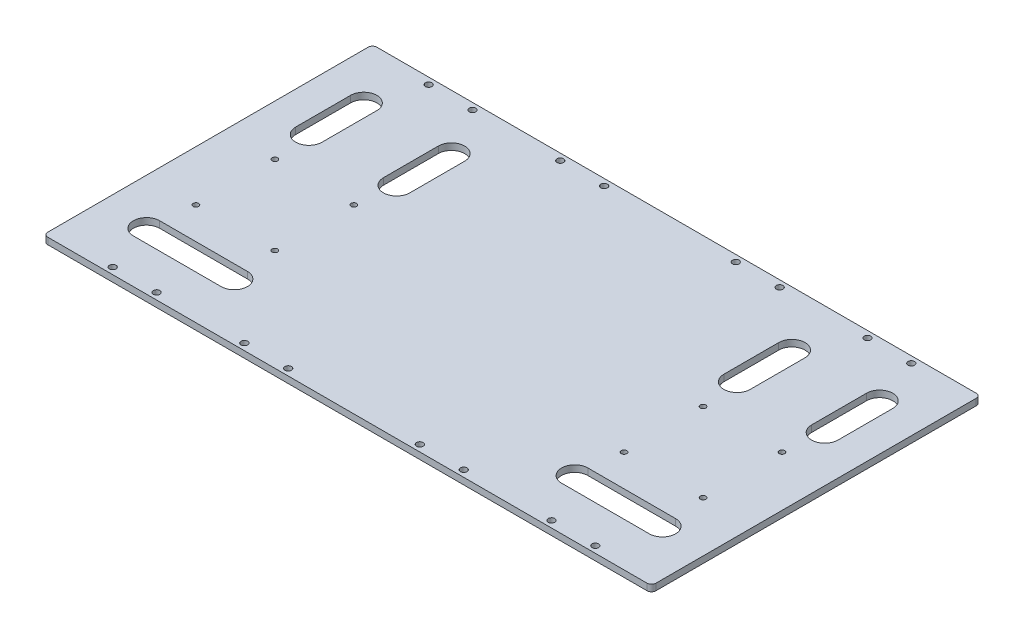
from build123d import *

# Parameters (mm, degrees)
SKETCH_1_W             = 277.163859754
SKETCH_1_H             = 150
EXTRUDE_1_DEPTH        = 3
SKETCH_2_R             = 1.5
CUT_EXTRUDE_1_DEPTH    = 10
CUT_EXTRUDE_2_DEPTH    = 10
FILLET_1_R             = 2
SKETCH_4_R             = 1.25
CUT_EXTRUDE_2556_DEPTH = 10


with BuildPart() as part:
    # 草图1 → 凸台-拉伸1 (new body)
    with BuildSketch(Plane(origin=(0, 0, 0), x_dir=(1, 0, 0), z_dir=(0, 1, 0))):
        with Locations((0, 132.402514855)):
            Rectangle(SKETCH_1_W, SKETCH_1_H)
    extrude(amount=EXTRUDE_1_DEPTH)

    # 草图2 → 切除-拉伸1 (cut)
    with BuildSketch(Plane(origin=(0, 3, 0), x_dir=(1, 0, 0), z_dir=(0, 1, 0))):
        with Locations(Location((-50, 60.402514855, 0), (0, 0, 270))):
            Circle(SKETCH_2_R)
        with Locations(Location((-30, 60.402514855, 0), (0, 0, 270))):
            Circle(SKETCH_2_R)
        with Locations(Location((-110, 60.402514855, 0), (0, 0, 270))):
            Circle(SKETCH_2_R)
        with Locations(Location((-90, 60.402514855, 0), (0, 0, 270))):
            Circle(SKETCH_2_R)
        with Locations(Location((90, 60.402514855, 0), (0, 0, 90))):
            Circle(SKETCH_2_R)
        with Locations(Location((110, 60.402514855, 0), (0, 0, 90))):
            Circle(SKETCH_2_R)
        with Locations(Location((30, 60.402514855, 0), (0, 0, 90))):
            Circle(SKETCH_2_R)
        with Locations(Location((50, 60.402514855, 0), (0, 0, 90))):
            Circle(SKETCH_2_R)
        with Locations(Location((50, 204.402514855, 0), (0, 0, 270))):
            Circle(SKETCH_2_R)
        with Locations(Location((30, 204.402514855, 0), (0, 0, 270))):
            Circle(SKETCH_2_R)
        with Locations(Location((110, 204.402514855, 0), (0, 0, 270))):
            Circle(SKETCH_2_R)
        with Locations(Location((90, 204.402514855, 0), (0, 0, 270))):
            Circle(SKETCH_2_R)
        with Locations(Location((-90, 204.402514855, 0), (0, 0, 90))):
            Circle(SKETCH_2_R)
        with Locations(Location((-110, 204.402514855, 0), (0, 0, 90))):
            Circle(SKETCH_2_R)
        with Locations(Location((-30, 204.402514855, 0), (0, 0, 90))):
            Circle(SKETCH_2_R)
        with Locations(Location((-50, 204.402514855, 0), (0, 0, 90))):
            Circle(SKETCH_2_R)
    extrude(amount=-CUT_EXTRUDE_1_DEPTH, mode=Mode.SUBTRACT)

    # 草图3 → 切除-拉伸2 (cut)
    with BuildSketch(Plane(origin=(0, 3, 0), x_dir=(1, 0, 0), z_dir=(0, 1, 0))):
        with BuildLine():
            Line((-117.581929877, 89.402514855), (-77.581929877, 89.402514855))
            ThreePointArc((-77.581929877, 89.402514855), (-71.581929877, 83.402514855), (-77.581929877, 77.402514855))
            Line((-77.581929877, 77.402514855), (-117.581929877, 77.402514855))
            ThreePointArc((-117.581929877, 77.402514855), (-123.581929877, 83.402514855), (-117.581929877, 89.402514855))
        make_face()
        with BuildLine():
            Line((-111.581929877, 182.402514855), (-111.581929877, 157.402514855))
            ThreePointArc((-111.581929877, 157.402514855), (-117.581929877, 151.402514855), (-123.581929877, 157.402514855))
            Line((-123.581929877, 157.402514855), (-123.581929877, 182.402514855))
            ThreePointArc((-123.581929877, 182.402514855), (-117.581929877, 188.402514855), (-111.581929877, 182.402514855))
        make_face()
        with BuildLine():
            Line((-71.581929877, 182.402514855), (-71.581929877, 157.402514855))
            ThreePointArc((-71.581929877, 157.402514855), (-77.581929877, 151.402514855), (-83.581929877, 157.402514855))
            Line((-83.581929877, 157.402514855), (-83.581929877, 182.402514855))
            ThreePointArc((-83.581929877, 182.402514855), (-77.581929877, 188.402514855), (-71.581929877, 182.402514855))
        make_face()
        with BuildLine():
            Line((117.581929877, 89.402514855), (77.581929877, 89.402514855))
            ThreePointArc((77.581929877, 89.402514855), (71.581929877, 83.402514855), (77.581929877, 77.402514855))
            Line((77.581929877, 77.402514855), (117.581929877, 77.402514855))
            ThreePointArc((117.581929877, 77.402514855), (123.581929877, 83.402514855), (117.581929877, 89.402514855))
        make_face()
        with BuildLine():
            Line((111.581929877, 182.402514855), (111.581929877, 157.402514855))
            ThreePointArc((111.581929877, 157.402514855), (117.581929877, 151.402514855), (123.581929877, 157.402514855))
            Line((123.581929877, 157.402514855), (123.581929877, 182.402514855))
            ThreePointArc((123.581929877, 182.402514855), (117.581929877, 188.402514855), (111.581929877, 182.402514855))
        make_face()
        with BuildLine():
            Line((71.581929877, 182.402514855), (71.581929877, 157.402514855))
            ThreePointArc((71.581929877, 157.402514855), (77.581929877, 151.402514855), (83.581929877, 157.402514855))
            Line((83.581929877, 157.402514855), (83.581929877, 182.402514855))
            ThreePointArc((83.581929877, 182.402514855), (77.581929877, 188.402514855), (71.581929877, 182.402514855))
        make_face()
    extrude(amount=-CUT_EXTRUDE_2_DEPTH, mode=Mode.SUBTRACT)

    # 圆角1
    fillet_1_edges = [part.edges().sort_by_distance(p)[0] for p in [
        (-138.581929877, 1.5, -207.402514855),
        (138.581929877, 1.5, -207.402514855),
        (138.581929877, 1.5, -57.402514855),
        (-138.581929877, 1.5, -57.402514855),
    ]]
    fillet(fillet_1_edges, radius=FILLET_1_R)

    # 草图4 → Cut-Extrude 2556 (cut)
    with BuildSketch(Plane(origin=(0, 3, 0), x_dir=(1, 0, 0), z_dir=(0, 1, 0))):
        with Locations(Location((-115.581929877, 139.902514855, 0), (0, 0, 270))):
            Circle(SKETCH_4_R)
        with Locations(Location((-79.581929877, 139.902514855, 0), (0, 0, 270))):
            Circle(SKETCH_4_R)
        with Locations(Location((-79.581929877, 103.902514855, 0), (0, 0, 270))):
            Circle(SKETCH_4_R)
        with Locations(Location((-115.581929877, 103.902514855, 0), (0, 0, 270))):
            Circle(SKETCH_4_R)
        with Locations(Location((115.581929877, 103.902514855, 0), (0, 0, 90))):
            Circle(SKETCH_4_R)
        with Locations(Location((79.581929877, 103.902514855, 0), (0, 0, 90))):
            Circle(SKETCH_4_R)
        with Locations(Location((79.581929877, 139.902514855, 0), (0, 0, 90))):
            Circle(SKETCH_4_R)
        with Locations(Location((115.581929877, 139.902514855, 0), (0, 0, 90))):
            Circle(SKETCH_4_R)
    extrude(amount=-CUT_EXTRUDE_2556_DEPTH, mode=Mode.SUBTRACT)


solid = part.part
